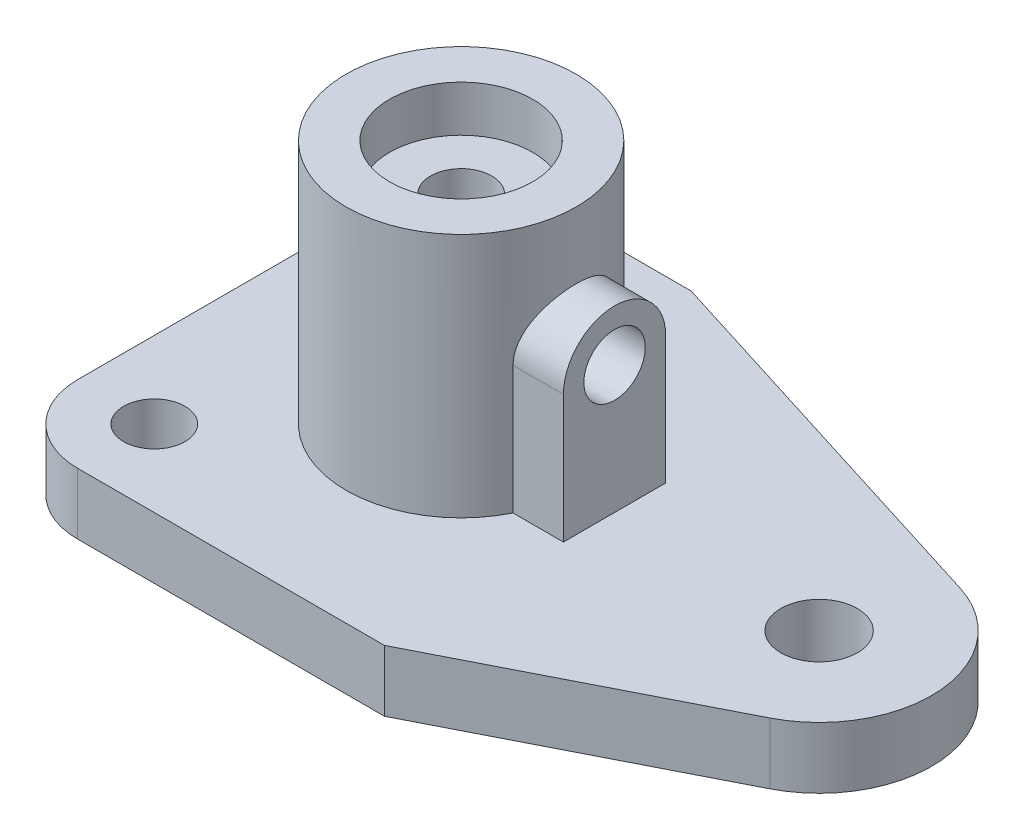
from build123d import *

# Parameters (mm, degrees)
SKETCH1_R           = 6
SKETCH1_R_2         = 7.5
BOSS_EXTRUDE1_DEPTH = 12
SKETCH2_R           = 22.5
BOSS_EXTRUDE2_DEPTH = 48
HOLE1_D             = 12
HOLE1_DEPTH         = 100
HOLE1_CBORE_D       = 28
HOLE1_CBORE_DEPTH   = 9
BOSS_EXTRUDE5_START = 15
BOSS_EXTRUDE5_DEPTH = 15
HOLE2_REACH         = 108.066
HOLE2_BORE_R        = 6


with BuildPart() as part:
    # Sketch1 → Boss-Extrude1 (new body)
    with BuildSketch(Plane(origin=(0, 0, 0), x_dir=(1, 0, 0), z_dir=(0, 1, 0))):
        with BuildLine():
            Line((-45, 30), (-45, -30))
            ThreePointArc((-45, -30), (-40.606601718, -40.606601718), (-30, -45))
            Line((-30, -45), (30, -45))
            Line((30, -45), (79.965290711, -19.613591743))
            ThreePointArc((79.965290711, -19.613591743), (91.923986167, 1.827246717), (76.580979422, 20.992634657))
            Line((76.580979422, 20.992634657), (0, 45))
            Line((0, 45), (-30, 45))
            ThreePointArc((-30, 45), (-40.606601718, 40.606601718), (-45, 30))
        make_face()
        with Locations(Location((-30, 30, 0), (0, 0, 270))):
            Circle(SKETCH1_R, mode=Mode.SUBTRACT)
        with Locations(Location((-30, -30, 0), (0, 0, 270))):
            Circle(SKETCH1_R, mode=Mode.SUBTRACT)
        with Locations(Location((70, 0, 0), (0, 0, 270))):
            Circle(SKETCH1_R_2, mode=Mode.SUBTRACT)
    extrude(amount=BOSS_EXTRUDE1_DEPTH)

    # Sketch2 → Boss-Extrude2 (add)
    with BuildSketch(Plane(origin=(0, 12, 0), x_dir=(1, 0, 0), z_dir=(0, 1, 0))):
        with Locations(Location((0, 0, 0), (0, 0, 270))):
            Circle(SKETCH2_R)
    extrude(amount=BOSS_EXTRUDE2_DEPTH)

    # Hole1
    with Locations(Plane(origin=(0, 60, 0), x_dir=(1, 0, 0), z_dir=(0, 1, 0))):
        with Locations((0, 0)):
            CounterBoreHole(HOLE1_D / 2, HOLE1_CBORE_D / 2, HOLE1_CBORE_DEPTH, depth=HOLE1_DEPTH)

    # Sketch5 → Boss-Extrude5 (add)
    with BuildSketch(Plane(origin=(0, 0, 0), x_dir=(0, 0, -1), z_dir=(1, 0, 0)).offset(BOSS_EXTRUDE5_START)):
        with BuildLine():
            Line((-10, 37), (-10, 0))
            Line((-10, 0), (10, 0))
            Line((10, 0), (10, 37))
            ThreePointArc((10, 37), (0, 47), (-10, 37))
        make_face()
    extrude(amount=BOSS_EXTRUDE5_DEPTH)

    # Hole2 bore → Hole2 (cut, up to next)
    with BuildSketch(Plane(origin=(30, 0, 0), x_dir=(0, 0, -1), z_dir=(1, 0, 0)), mode=Mode.PRIVATE) as hole2_sk1:
        with Locations((0, 37)):
            Circle(HOLE2_BORE_R)
    hole2_tool1 = extrude(hole2_sk1.sketch, amount=-HOLE2_REACH, mode=Mode.PRIVATE) & part.part
    add(hole2_tool1.solids().sort_by_distance((30, 37, 0))[0], mode=Mode.SUBTRACT)


solid = part.part
